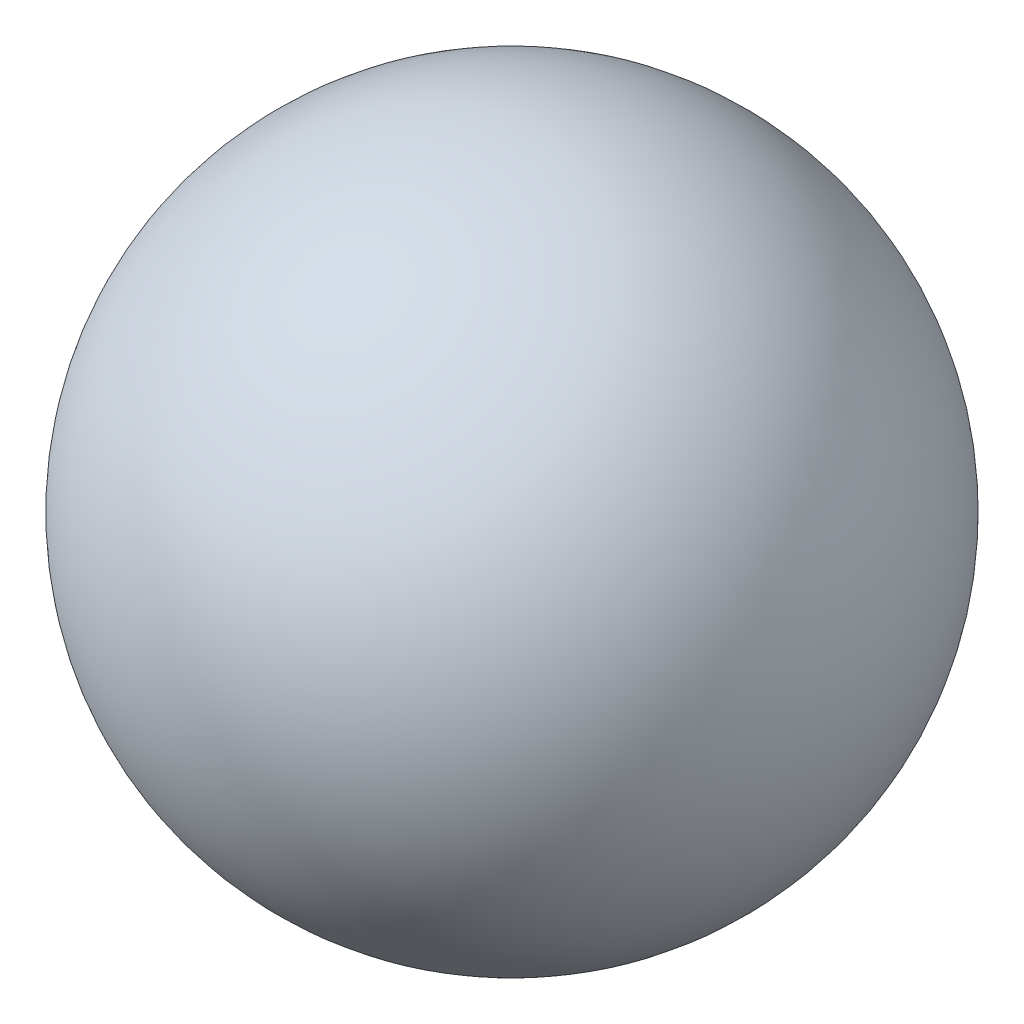
from build123d import *


with BuildPart() as part:
    # Эскиз1 → Повернуть1 (revolve)
    with BuildSketch(Plane.XY):
        with BuildLine():
            Line((0, 0), (0, 30))
            ThreePointArc((0, 30), (30, 0), (0, -30))
            Line((0, -30), (0, 0))
        make_face()
    revolve(axis=Axis((0, 0, 0), (0, 1, 0)))


solid = part.part
